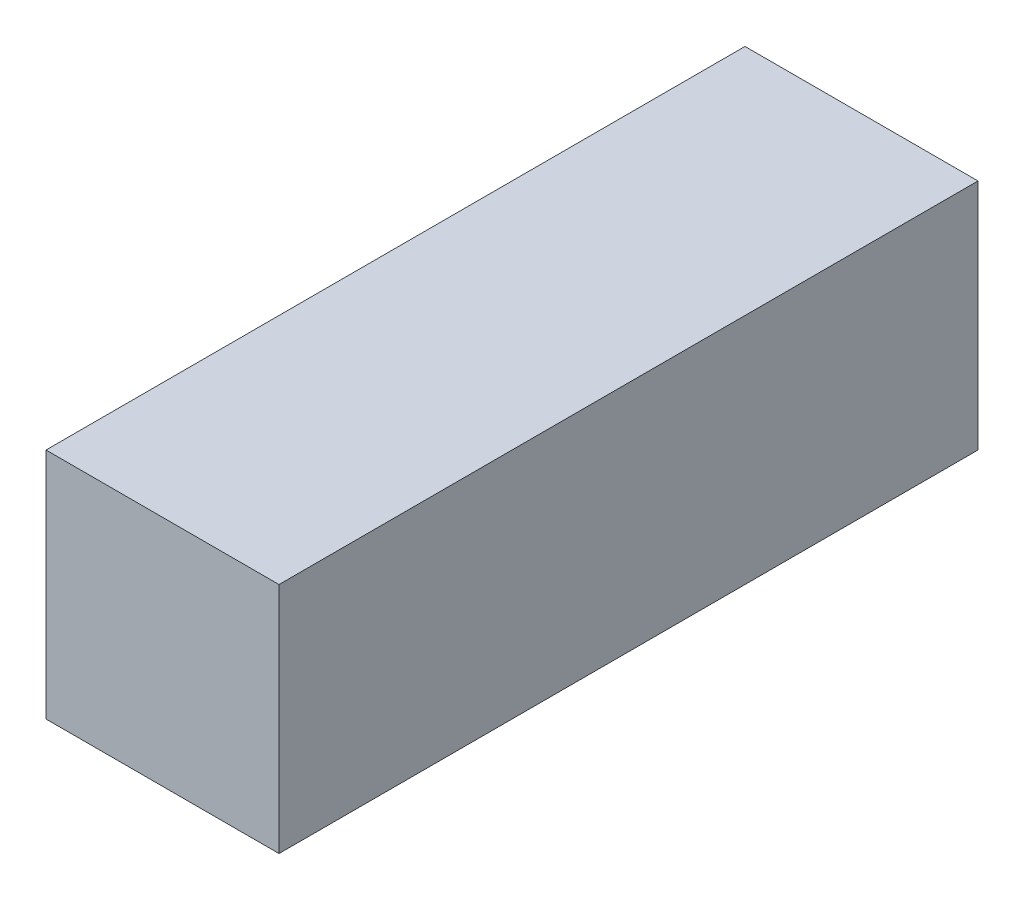
from build123d import *

# Parameters (mm, degrees)
SKETCH1_W           = 5
SKETCH1_H           = 5
BOSS_EXTRUDE1_DEPTH = 15


with BuildPart() as part:
    # Sketch1 → Boss-Extrude1 (new body)
    with BuildSketch(Plane.XY):
        with Locations((2.5, 2.5)):
            Rectangle(SKETCH1_W, SKETCH1_H)
    extrude(amount=BOSS_EXTRUDE1_DEPTH)


solid = part.part
